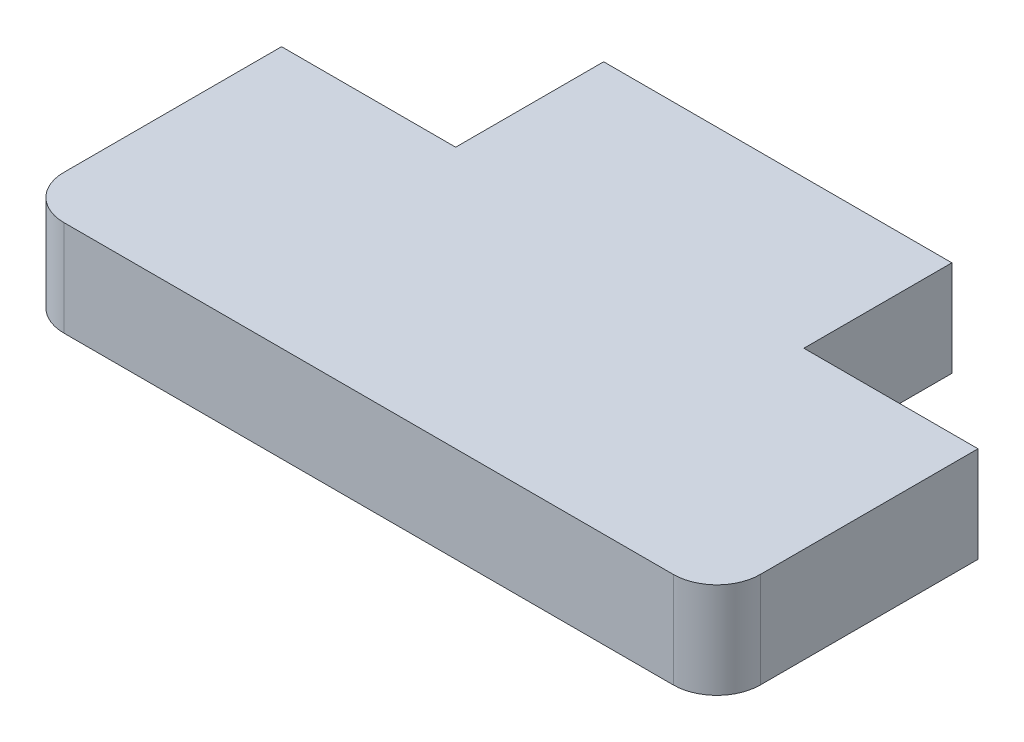
from build123d import *

# Parameters (mm, degrees)
BOSS_EXTRUDE1_DEPTH = 5.5
FILLET1_R           = 2.5


with BuildPart() as part:
    # Sketch1 → Boss-Extrude1 (new body)
    with BuildSketch(Plane(origin=(0, 0, 0), x_dir=(1, 0, 0), z_dir=(0, 1, 0))):
        Polygon((0, 0), (-10, 0), (-10, -15), (30, -15), (30, 0), (20, 0), (20, 8.5), (0, 8.5), align=None)
    extrude(amount=BOSS_EXTRUDE1_DEPTH)

    # Fillet1
    fillet1_edges = [part.edges().sort_by_distance(p)[0] for p in [
        (30, 2.75, 15),
        (-10, 2.75, 15),
    ]]
    fillet(fillet1_edges, radius=FILLET1_R)


solid = part.part
